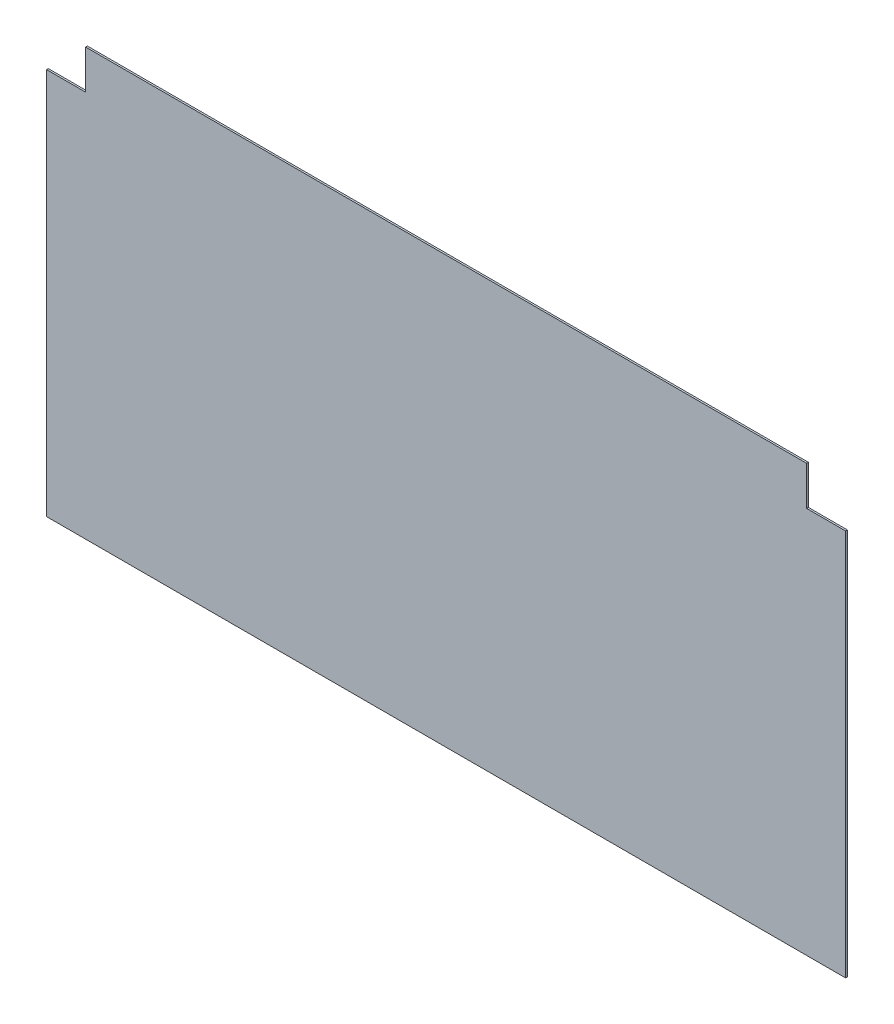
from build123d import *

# Parameters (mm, degrees)
SKETCH1_W           = 450
SKETCH1_H           = 240
BOSS_EXTRUDE1_DEPTH = 1
SKETCH2_W           = 22
SKETCH2_H           = 22
CUT_EXTRUDE1_DEPTH  = 10


with BuildPart() as part:
    # Sketch1 → Boss-Extrude1 (new body)
    with BuildSketch(Plane.XY):
        Rectangle(SKETCH1_W, SKETCH1_H)
    extrude(amount=BOSS_EXTRUDE1_DEPTH)

    # Sketch2 → Cut-Extrude1 (cut)
    with BuildSketch(Plane.XY.offset(1)):
        with Locations((-214, 109)):
            Rectangle(SKETCH2_W, SKETCH2_H)
        with Locations((214, 109)):
            Rectangle(SKETCH2_W, SKETCH2_H)
    extrude(amount=-CUT_EXTRUDE1_DEPTH, mode=Mode.SUBTRACT)


solid = part.part
